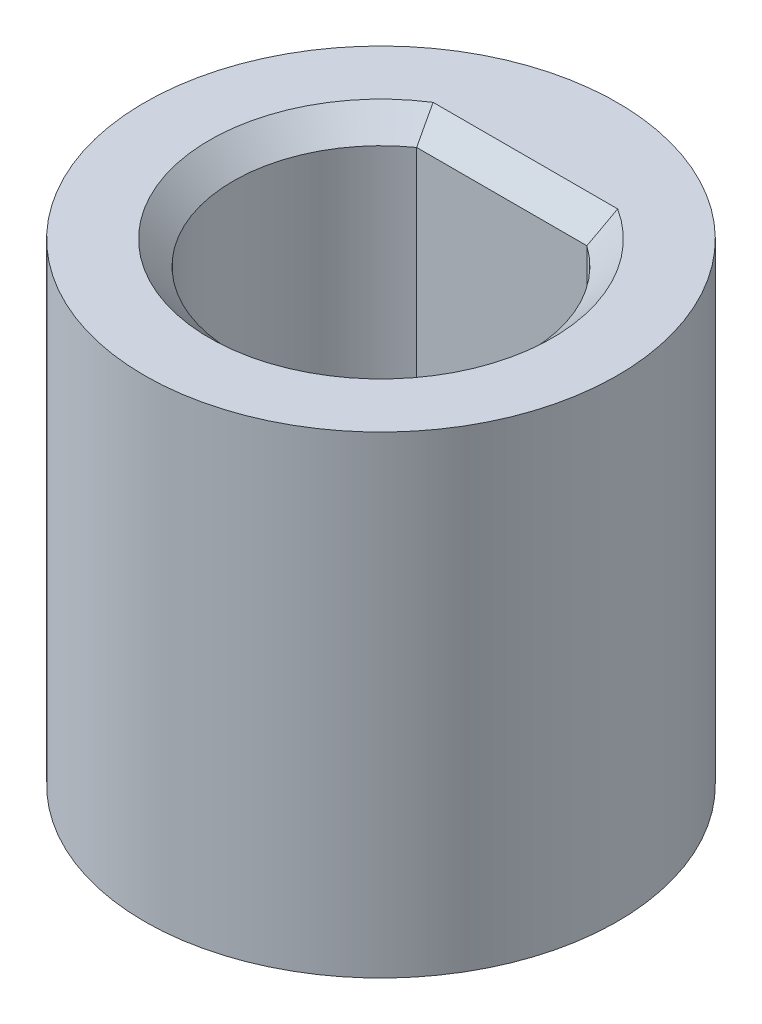
from build123d import *

# Parameters (mm, degrees)
SKETCH1_R           = 5
BOSS_EXTRUDE1_DEPTH = 10
CUT_EXTRUDE1_DEPTH  = 8
CHAMFER1_SIZE       = 0.5


with BuildPart() as part:
    # Sketch1 → Boss-Extrude1 (new body)
    with BuildSketch(Plane(origin=(0, 0, 0), x_dir=(1, 0, 0), z_dir=(0, 1, 0))):
        with Locations(Location((0, 0, 0), (0, 0, 270))):
            Circle(SKETCH1_R)
    extrude(amount=BOSS_EXTRUDE1_DEPTH)

    # Sketch2 → Cut-Extrude1 (cut)
    with BuildSketch(Plane(origin=(0, 10, 0), x_dir=(1, 0, 0), z_dir=(0, 1, 0))):
        with BuildLine():
            Line((-1.79933321, 2.555), (1.79933321, 2.555))
            ThreePointArc((1.79933321, 2.555), (0, -3.125), (-1.79933321, 2.555))
        make_face()
    extrude(amount=-CUT_EXTRUDE1_DEPTH, mode=Mode.SUBTRACT)

    # Chamfer1
    chamfer1_edges = [part.edges().sort_by_distance(p)[0] for p in [
        (0, 10, 3.125),
        (0, 10, -2.555),
    ]]
    chamfer(chamfer1_edges, length=CHAMFER1_SIZE)


solid = part.part
